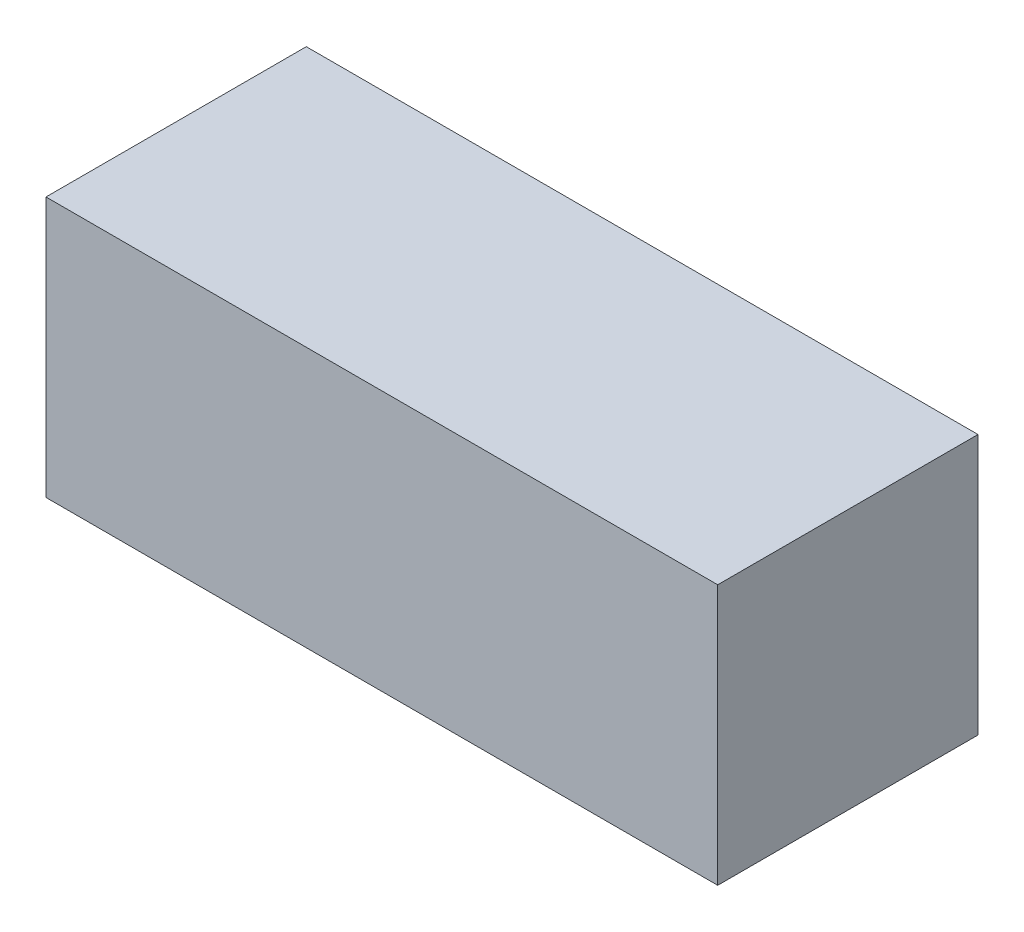
from build123d import *

# Parameters (mm, degrees)
SKETCH1_W      = 6096
SKETCH1_H      = 2362.2
EXTRUDE1_DEPTH = 2362.2


with BuildPart() as part:
    # Sketch1 → Extrude1 (new body)
    with BuildSketch(Plane(origin=(0, 0, 0), x_dir=(1, 0, 0), z_dir=(0, 1, 0))):
        with Locations((3048, 0)):
            Rectangle(SKETCH1_W, SKETCH1_H)
    extrude(amount=EXTRUDE1_DEPTH)


solid = part.part
